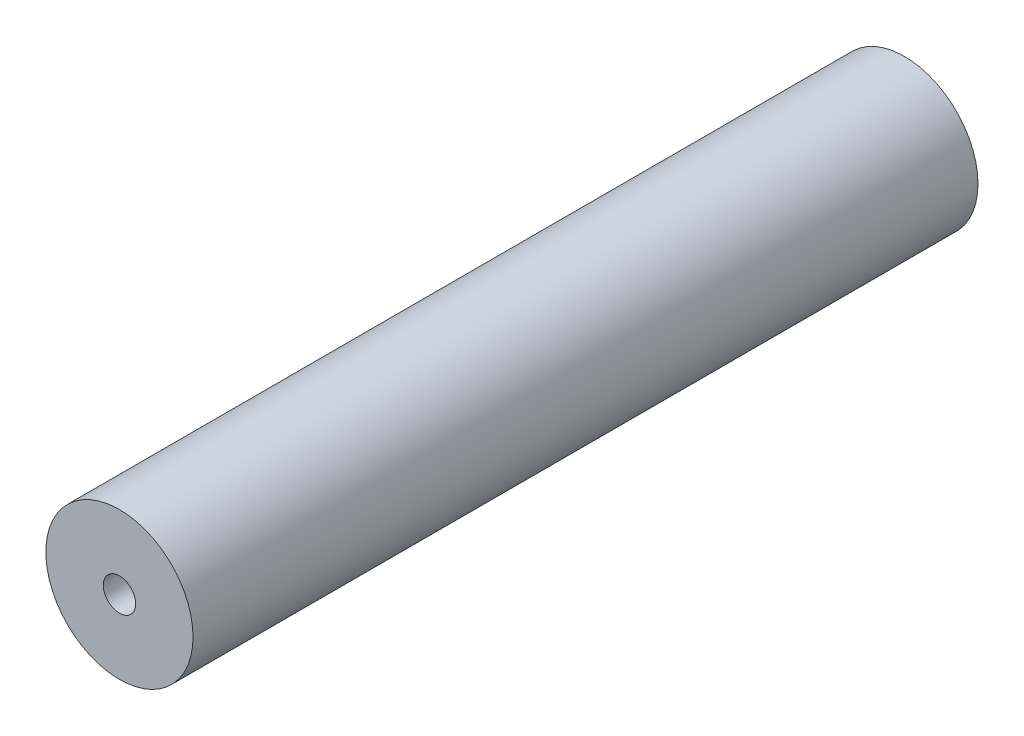
from build123d import *

# Parameters (mm, degrees)
SKETCH_1_R          = 7.5
EXTRUDE_1_DEPTH     = 80
SKETCH_2_R          = 1.65
CUT_EXTRUDE_1_DEPTH = 10


with BuildPart() as part:
    # ｽｹｯﾁ1 → ﾎﾞｽ - 押し出し1 (new body)
    with BuildSketch(Plane.XY):
        Circle(SKETCH_1_R)
    extrude(amount=EXTRUDE_1_DEPTH)

    # ｽｹｯﾁ2 → ｶｯﾄ - 押し出し1 (cut)
    with BuildSketch(Plane.XY.offset(80)):
        Circle(SKETCH_2_R)
    cut_extrude_1 = extrude(amount=-CUT_EXTRUDE_1_DEPTH, mode=Mode.SUBTRACT)

    # ﾐﾗｰ1: ｶｯﾄ - 押し出し1 across plane
    add(cut_extrude_1.mirror(Plane.XY.offset(40)), mode=Mode.SUBTRACT)


solid = part.part
